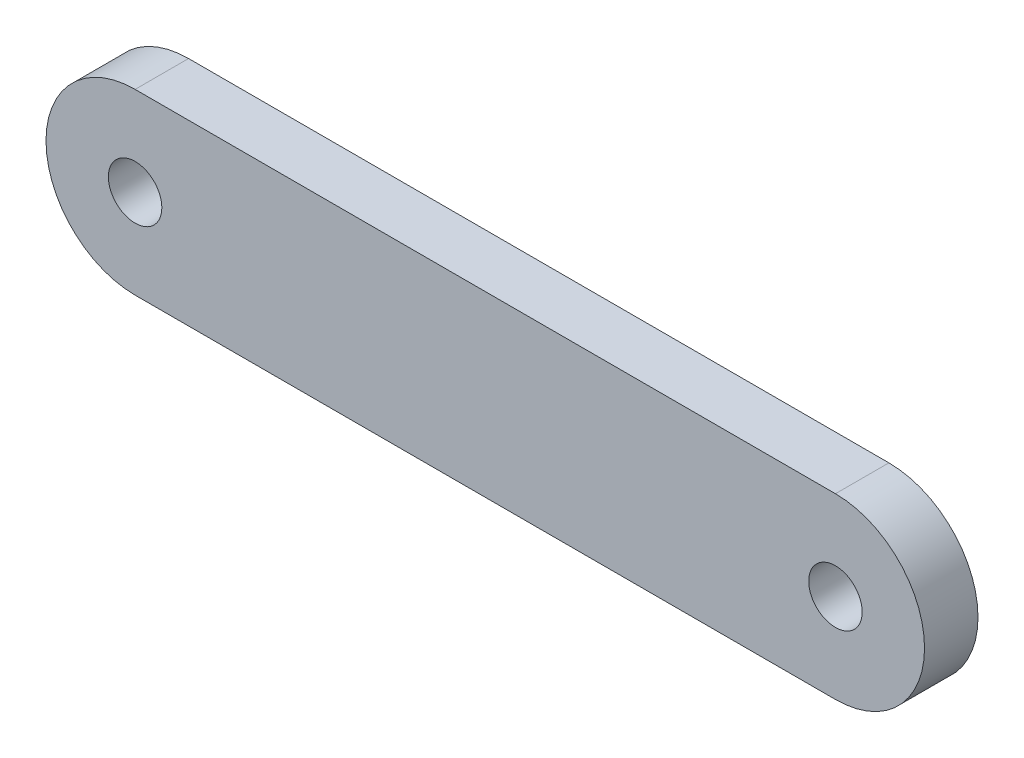
from build123d import *

# Parameters (mm, degrees)
SKETCH1_R           = 1.5
BOSS_EXTRUDE1_DEPTH = 3


with BuildPart() as part:
    # Sketch1 → Boss-Extrude1 (new body)
    with BuildSketch(Plane.XY):
        with BuildLine():
            Line((0, 5), (39.3, 5))
            ThreePointArc((39.3, 5), (44.3, 0), (39.3, -5))
            Line((39.3, -5), (0, -5))
            ThreePointArc((0, -5), (-5, 0), (0, 5))
        make_face()
        Circle(SKETCH1_R, mode=Mode.SUBTRACT)
        with Locations((39.3, 0)):
            Circle(SKETCH1_R, mode=Mode.SUBTRACT)
    extrude(amount=BOSS_EXTRUDE1_DEPTH)


solid = part.part
